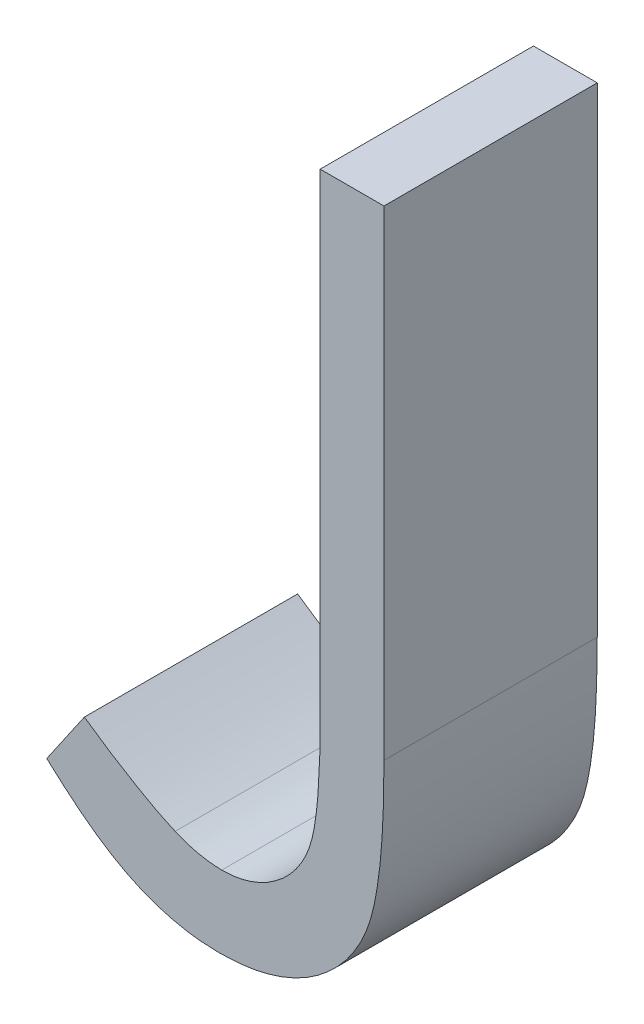
from build123d import *

# Parameters (mm, degrees)
BOSS_EXTRU_1_DEPTH = 1.5


with BuildPart() as part:
    # Esquisse1 → Boss.-Extru.1 (new body)
    with BuildSketch(Plane.XY):
        with BuildLine():
            Line((-53.829901223, -17.870119076), (-53.381183275, -17.870119076))
            Line((-53.381183275, -17.870119076), (-53.381183275, -21.24652132))
            add(Edge.make_bspline(
                [(-53.381183275, -21.24652132), (-53.38163173, -21.308957278), (-53.382492818, -21.428841937), (-53.387227691, -21.601518931), (-53.395989802, -21.75919134), (-53.408754106, -21.902217693), (-53.42578301, -22.030149915), (-53.445270193, -22.143976512), (-53.468859905, -22.242747486), (-53.504383428, -22.353655137), (-53.562631926, -22.475289144), (-53.650299124, -22.606653645), (-53.759203119, -22.721558517), (-53.885347452, -22.821348124), (-54.029834629, -22.900858455), (-54.189689228, -22.957937281), (-54.36392721, -22.99275279), (-54.484783227, -22.996429798), (-54.547048659, -22.998324204)],
                knots=[0, 0, 0, 0, 1.237770943, 2.376671248, 3.424123796, 4.367912054, 5.222547132, 5.982086412, 6.656319012, 7.234008312, 8.288027371, 9.317870876, 10.352700517, 11.413286737, 12.494591526, 13.606319346, 14.766767577, 16, 16, 16, 16], degree=3))
            add(Edge.make_bspline(
                [(-54.547048659, -22.998324204), (-54.5955606, -22.996780477), (-54.693169837, -22.993674395), (-54.838442278, -22.968357663), (-54.983302243, -22.929334743), (-55.128518599, -22.872188179), (-55.276960372, -22.794465895), (-55.43063801, -22.6927733), (-55.591528283, -22.567299691), (-55.697504406, -22.471531483), (-55.752978146, -22.421401128)],
                knots=[0, 0, 0, 0, 0.848567217, 1.707373443, 2.573483905, 3.470863513, 4.432650262, 5.500696352, 6.691726801, 8, 8, 8, 8], degree=3))
            Line((-55.752978146, -22.421401128), (-55.488555069, -22.036785743))
            add(Edge.make_bspline(
                [(-55.488555069, -22.036785743), (-55.427551242, -22.078853452), (-55.312368062, -22.158282771), (-55.143076004, -22.260463629), (-54.993080071, -22.348071008), (-54.894961575, -22.392717121), (-54.849532634, -22.413388307)],
                knots=[0, 0, 0, 0, 1.196737151, 2.259595785, 3.194191475, 4, 4, 4, 4], degree=3))
            add(Edge.make_bspline(
                [(-54.849532634, -22.413388307), (-54.821983617, -22.424187532), (-54.767953861, -22.445367216), (-54.685346604, -22.469004214), (-54.603210837, -22.481921942), (-54.548756989, -22.484323847), (-54.522008595, -22.485503692)],
                knots=[0, 0, 0, 0, 1.051806502, 2.062826769, 3.048436908, 4, 4, 4, 4], degree=3))
            add(Edge.make_bspline(
                [(-54.522008595, -22.485503692), (-54.487461754, -22.484042642), (-54.419175388, -22.481154685), (-54.319941111, -22.45565572), (-54.225001067, -22.416735144), (-54.137758699, -22.359747582), (-54.057351003, -22.291988409), (-53.991004109, -22.210051254), (-53.93569376, -22.119242706), (-53.902408484, -22.033283486), (-53.881201666, -21.9548883), (-53.867742199, -21.882840963), (-53.855972685, -21.798610279), (-53.845713325, -21.702095707), (-53.839706938, -21.593104019), (-53.832967977, -21.471955243), (-53.83053189, -21.33834394), (-53.83011786, -21.245185437), (-53.829901223, -21.196441192)],
                knots=[0, 0, 0, 0, 0.997221856, 1.971139923, 2.944579524, 3.951425367, 4.971190333, 5.972282193, 6.985401279, 8.033996657, 8.624075553, 9.332086008, 10.151144245, 11.082816738, 12.137127781, 13.306538797, 14.590673636, 16, 16, 16, 16], degree=3))
            Line((-53.829901223, -21.196441192), (-53.829901223, -17.870119076))
        make_face()
    extrude(amount=BOSS_EXTRU_1_DEPTH)


solid = part.part
